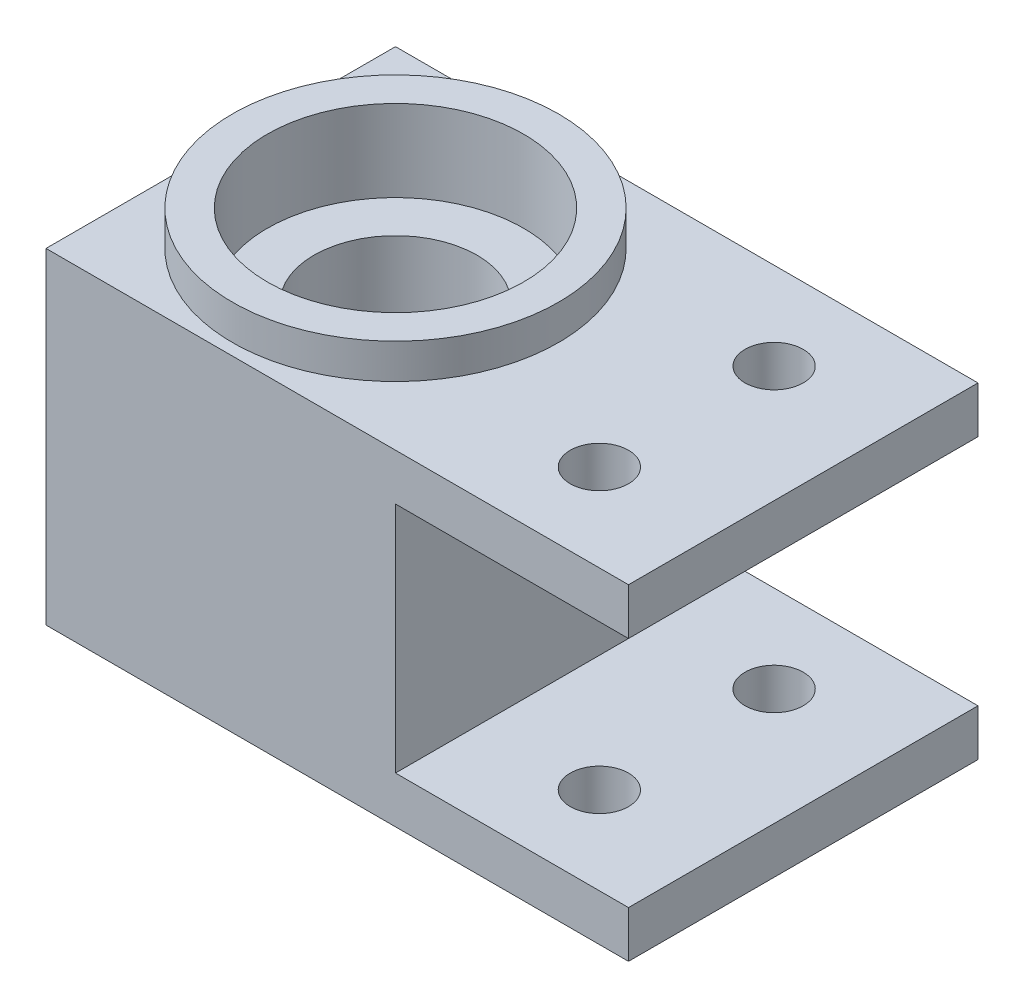
from build123d import *

# Parameters (mm, degrees)
SKETCH1_W                    = 50
SKETCH1_H                    = 30
BOSS_EXTRUDE1_DEPTH          = 28
SKETCH2_W                    = 20
SKETCH2_H                    = 20
CUT_EXTRUDE1_DEPTH           = 52.923019943
SKETCH3_W                    = 14
SKETCH3_H                    = 3
F_5_0_5_DIAMETER_HOLE1_D     = 5
F_5_0_5_DIAMETER_HOLE1_DEPTH = 7
F_5_0_5_DIAMETER_HOLE2_D     = 5
F_5_0_5_DIAMETER_HOLE2_DEPTH = 31


with BuildPart() as part:
    # Sketch1 → Boss-Extrude1 (new body)
    with BuildSketch(Plane(origin=(0, 14, 0), x_dir=(1, 0, 0), z_dir=(0, 1, 0))):
        with Locations((-15, -15)):
            Rectangle(SKETCH1_W, SKETCH1_H)
    extrude(amount=-BOSS_EXTRUDE1_DEPTH)

    # Sketch2 → Cut-Extrude1 (cut, through all)
    with BuildSketch(Plane(origin=(0, 0, 0), x_dir=(-1, 0, 0), z_dir=(0, 0, -1))):
        Rectangle(SKETCH2_W, SKETCH2_H)
    extrude(amount=-CUT_EXTRUDE1_DEPTH, mode=Mode.SUBTRACT)

    # Sketch3 → Revolve1 (revolve)
    with BuildSketch(Plane.XY.offset(15), mode=Mode.PRIVATE) as revolve1_sk:
        with Locations((-18, 15.5)):
            Rectangle(SKETCH3_W, SKETCH3_H)
    revolve(revolve1_sk.sketch.rotate(Axis((-25, 17, 15), (0, -1, 0)), 270), axis=Axis((-25, 17, 15), (0, -1, 0)))

    # Sketch4 → Cut-Revolve1 (revolve, cut)
    with BuildSketch(Plane(origin=(0, 0, 15), x_dir=(-1, 0, 0), z_dir=(0, 0, -1)), mode=Mode.PRIVATE) as cut_revolve1_sk:
        Polygon((14, -14), (25, -14), (25, 17), (14, 17), (14, 10), (18, 10), (18, -7), (14, -7), align=None)
    revolve(cut_revolve1_sk.sketch.rotate(Axis((-25, -14, 15), (0, 1, 0)), 270), axis=Axis((-25, -14, 15), (0, 1, 0)), mode=Mode.SUBTRACT)

    # Ø5.0 (5) Diameter Hole1
    with Locations(Plane(origin=(0, 10, 0), x_dir=(-1, 0, 0), z_dir=(0, -1, 0))):
        with Locations((0, -7.5), (0, -22.5)):
            Hole(F_5_0_5_DIAMETER_HOLE1_D / 2, depth=F_5_0_5_DIAMETER_HOLE1_DEPTH)

    # Ø5.0 (5) Diameter Hole2
    with Locations(Plane(origin=(0, -14, 0), x_dir=(-1, 0, 0), z_dir=(0, -1, 0))):
        with Locations((0, -7.5), (0, -22.5)):
            Hole(F_5_0_5_DIAMETER_HOLE2_D / 2, depth=F_5_0_5_DIAMETER_HOLE2_DEPTH)


solid = part.part
